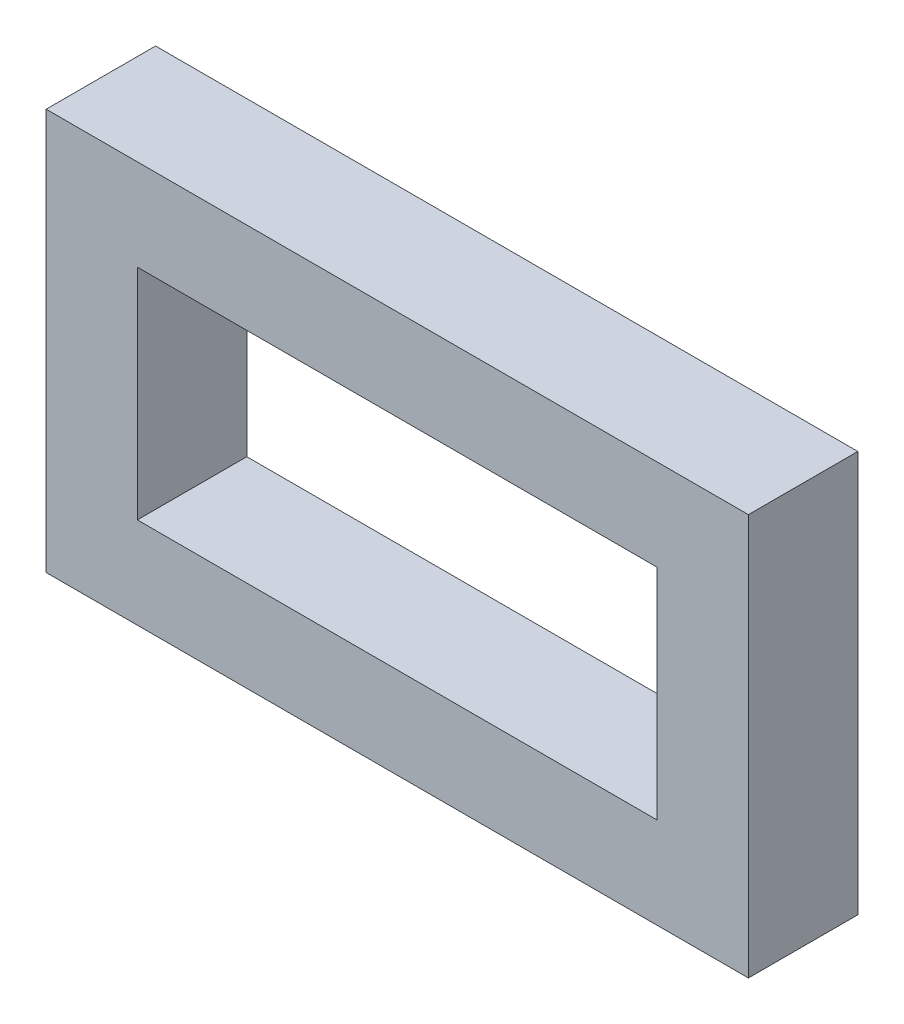
from build123d import *

# Parameters (mm, degrees)
ESQUISSE1_W        = 38.5
ESQUISSE1_H        = 22
ESQUISSE1_W_2      = 28.5
ESQUISSE1_H_2      = 12
BOSS_EXTRU_1_DEPTH = 6


with BuildPart() as part:
    # Esquisse1 → Boss.-Extru.1 (new body)
    with BuildSketch(Plane.XY):
        Rectangle(ESQUISSE1_W, ESQUISSE1_H)
        Rectangle(ESQUISSE1_W_2, ESQUISSE1_H_2, mode=Mode.SUBTRACT)
    extrude(amount=BOSS_EXTRU_1_DEPTH)


solid = part.part
